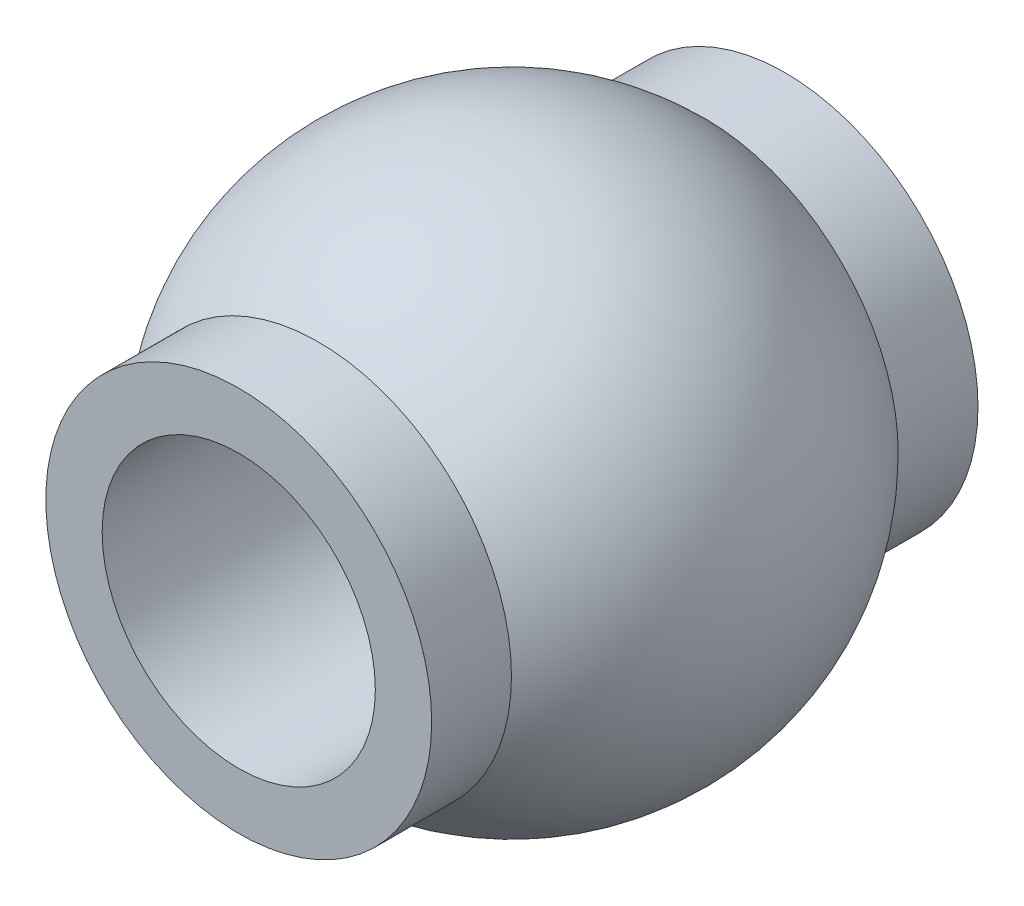
from build123d import *
from build123d.topology import SkipClean

# Parameters (mm, degrees)
SKETCH2_R           = 5.55625
EXTRUDE1_DEPTH      = 25.4
EXTRUDE2_REACH      = 26.641
SKETCH3_R           = 11.1125
BOSS_EXTRUDE1_START = 3.24566237
SKETCH4_R           = 7.8486
SKETCH4_R_2         = 5.55625
BOSS_EXTRUDE1_DEPTH = 3.24566237
SKETCH6_R           = 7.8486
SKETCH6_R_2         = 5.55625
BOSS_EXTRUDE2_DEPTH = 3.24566237


with BuildPart() as part:
    # Sketch1 → Revolve1 (revolve)
    with BuildSketch(Plane.XY):
        with BuildLine():
            Line((0, 11.1125), (0, -11.1125))
            ThreePointArc((0, -11.1125), (11.1125, 0), (0, 11.1125))
        make_face()
    revolve(axis=Axis((0, -11.1125, 0), (0, 1, 0)))

    # Sketch2 → Extrude1 (cut, symmetric)
    with BuildSketch(Plane.XY):
        with Locations(Location((0, 0, 0), (0, 0, 180))):
            Circle(SKETCH2_R)
    extrude(amount=EXTRUDE1_DEPTH, both=True, mode=Mode.SUBTRACT)

    # Sketch3 → Extrude2 (cut, up to next)
    with BuildSketch(Plane.XY.offset(7.86683763), mode=Mode.PRIVATE) as extrude2_sk1:
        Circle(SKETCH3_R)
    extrude2_tool1 = extrude(extrude2_sk1.sketch, amount=EXTRUDE2_REACH, mode=Mode.PRIVATE) & part.part
    extrude2 = extrude2_tool1.solids().sort_by_distance((0, 0, 7.866838))[0]
    add(extrude2, mode=Mode.SUBTRACT)

    # Sketch4 → Boss-Extrude1 (add)
    with SkipClean():  # the faces are left unmerged after this step: merging them gives an invalid solid
        with BuildSketch(Plane.XY.offset(7.86683763).offset(BOSS_EXTRUDE1_START)):
            Circle(SKETCH4_R)
            Circle(SKETCH4_R_2, mode=Mode.SUBTRACT)
        extrude(amount=-BOSS_EXTRUDE1_DEPTH)

    # Mirror1: Extrude2 across plane
    with SkipClean():  # the faces are left unmerged after this step: merging them gives an invalid solid
        add(extrude2.mirror(Plane.XY), mode=Mode.SUBTRACT)

    # Sketch6 → Boss-Extrude2 (add)
    with SkipClean():  # the faces are left unmerged after this step: merging them gives an invalid solid
        with BuildSketch(Plane(origin=(0, 0, -7.86683763), x_dir=(-1, 0, 0), z_dir=(0, 0, -1))):
            with Locations(Location((0, 0, 0), (0, 0, 180))):
                Circle(SKETCH6_R)
            with Locations(Location((0, 0, 0), (0, 0, 180))):
                Circle(SKETCH6_R_2, mode=Mode.SUBTRACT)
        extrude(amount=BOSS_EXTRUDE2_DEPTH)


solid = part.part
